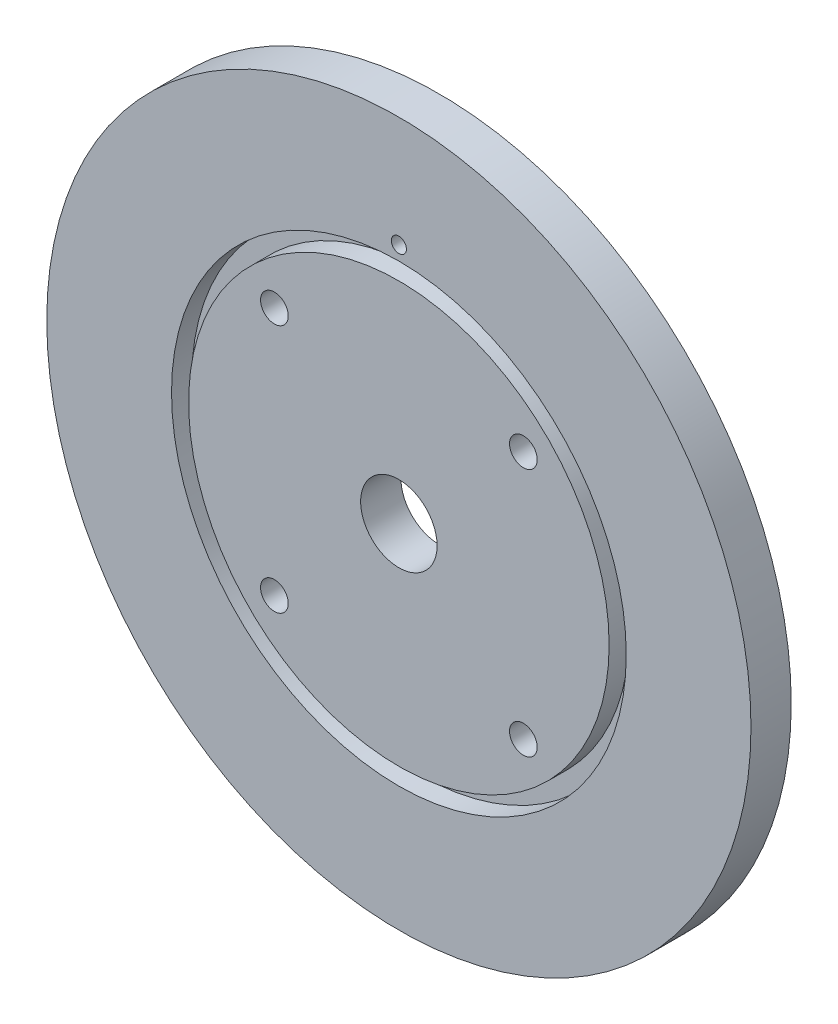
from build123d import *

# Parameters (mm, degrees)
SKETCH_1_R          = 70
SKETCH_1_R_2        = 7.6
SKETCH_1_R_3        = 2.75
SKETCH_1_R_4        = 1.5
EXTRUDE_1_DEPTH     = 8
SKETCH_2_R          = 45.2
SKETCH_2_R_2        = 41.8
CUT_EXTRUDE_2_DEPTH = 4


with BuildPart() as part:
    # 草图1 → 凸台-拉伸1 (new body)
    with BuildSketch(Plane.XY):
        Circle(SKETCH_1_R)
        Circle(SKETCH_1_R_2, mode=Mode.SUBTRACT)
        with Locations((24.748737342, 24.748737342)):
            Circle(SKETCH_1_R_3, mode=Mode.SUBTRACT)
        with Locations((-24.748737342, 24.748737342)):
            Circle(SKETCH_1_R_3, mode=Mode.SUBTRACT)
        with Locations((-24.748737342, -24.748737342)):
            Circle(SKETCH_1_R_3, mode=Mode.SUBTRACT)
        with Locations((24.748737342, -24.748737342)):
            Circle(SKETCH_1_R_3, mode=Mode.SUBTRACT)
        with Locations((0, 48)):
            Circle(SKETCH_1_R_4, mode=Mode.SUBTRACT)
    extrude(amount=-EXTRUDE_1_DEPTH)

    # 草图2 → 切除-拉伸2 (cut)
    with BuildSketch(Plane.XY):
        Circle(SKETCH_2_R)
        Circle(SKETCH_2_R_2, mode=Mode.SUBTRACT)
    extrude(amount=-CUT_EXTRUDE_2_DEPTH, mode=Mode.SUBTRACT)


solid = part.part
